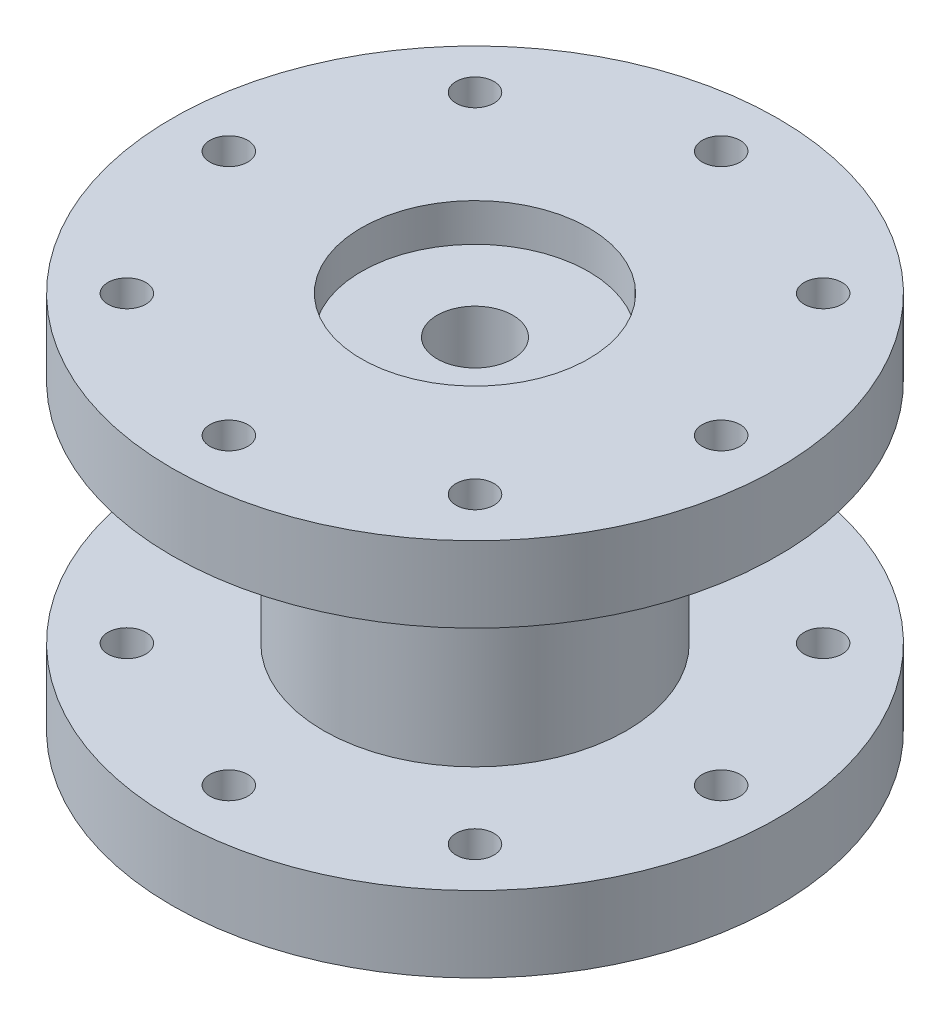
from build123d import *

# Parameters (mm, degrees)
SKETCH2_R          = 3.175
CUT_EXTRUDE1_DEPTH = 96.882897328


with BuildPart() as part:
    # Sketch1 → Revolve2 (revolve)
    with BuildSketch(Plane.XY, mode=Mode.PRIVATE) as revolve2_sk:
        Polygon((19.05, 0), (50.8, 0), (50.8, 12.7), (25.4, 12.7), (25.4, 50.8), (50.8, 50.8), (50.8, 63.5), (19.05, 63.5), (19.05, 57.15), (6.35, 57.15), (6.35, 6.35), (19.05, 6.35), align=None)
    revolve(revolve2_sk.sketch.rotate(Axis((0, 0, 0), (0, 1, 0)), 90), axis=Axis((0, 0, 0), (0, 1, 0)))

    # Sketch2 → Cut-Extrude1 (cut, through all)
    with BuildSketch(Plane(origin=(0, 63.5, 0), x_dir=(1, 0, 0), z_dir=(0, 1, 0))):
        with Locations(Location((41.275, 0, 0), (0, 0, 270))):
            Circle(SKETCH2_R)
        with Locations(Location((29.185832393, -29.185832393, 0), (0, 0, 270))):
            Circle(SKETCH2_R)
        with Locations(Location((0, -41.275, 0), (0, 0, 270))):
            Circle(SKETCH2_R)
        with Locations(Location((-29.185832393, -29.185832393, 0), (0, 0, 270))):
            Circle(SKETCH2_R)
        with Locations(Location((-41.275, 0, 0), (0, 0, 270))):
            Circle(SKETCH2_R)
        with Locations(Location((-29.185832393, 29.185832393, 0), (0, 0, 270))):
            Circle(SKETCH2_R)
        with Locations(Location((0, 41.275, 0), (0, 0, 270))):
            Circle(SKETCH2_R)
        with Locations(Location((29.185832393, 29.185832393, 0), (0, 0, 270))):
            Circle(SKETCH2_R)
    extrude(amount=-CUT_EXTRUDE1_DEPTH, mode=Mode.SUBTRACT)


solid = part.part
